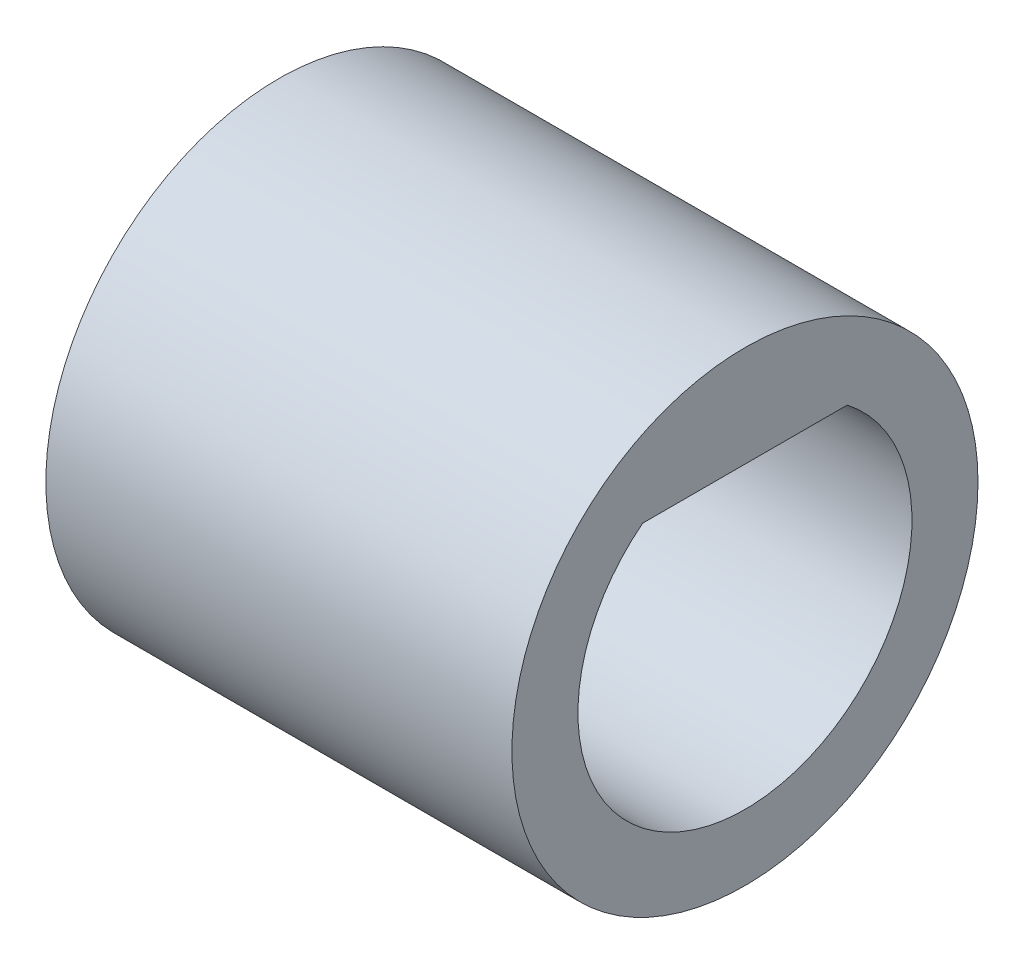
from build123d import *

# Parameters (mm, degrees)
SKETCH5_R           = 3
BOSS_EXTRUDE2_DEPTH = 6
CUT_EXTRUDE1_DEPTH  = 5


with BuildPart() as part:
    # Sketch5 → Boss-Extrude2 (new body)
    with BuildSketch(Plane(origin=(0, 0, 0), x_dir=(0, 0, -1), z_dir=(1, 0, 0))):
        Circle(SKETCH5_R)
    extrude(amount=BOSS_EXTRUDE2_DEPTH)

    # Sketch7 → Cut-Extrude1 (cut)
    with BuildSketch(Plane(origin=(6, 0, 0), x_dir=(0, 0, -1), z_dir=(1, 0, 0))):
        with BuildLine():
            Line((-1.316244658, 1.7), (1.316244658, 1.7))
            ThreePointArc((1.316244658, 1.7), (0, -2.15), (-1.316244658, 1.7))
        make_face()
    extrude(amount=-CUT_EXTRUDE1_DEPTH, mode=Mode.SUBTRACT)


solid = part.part
